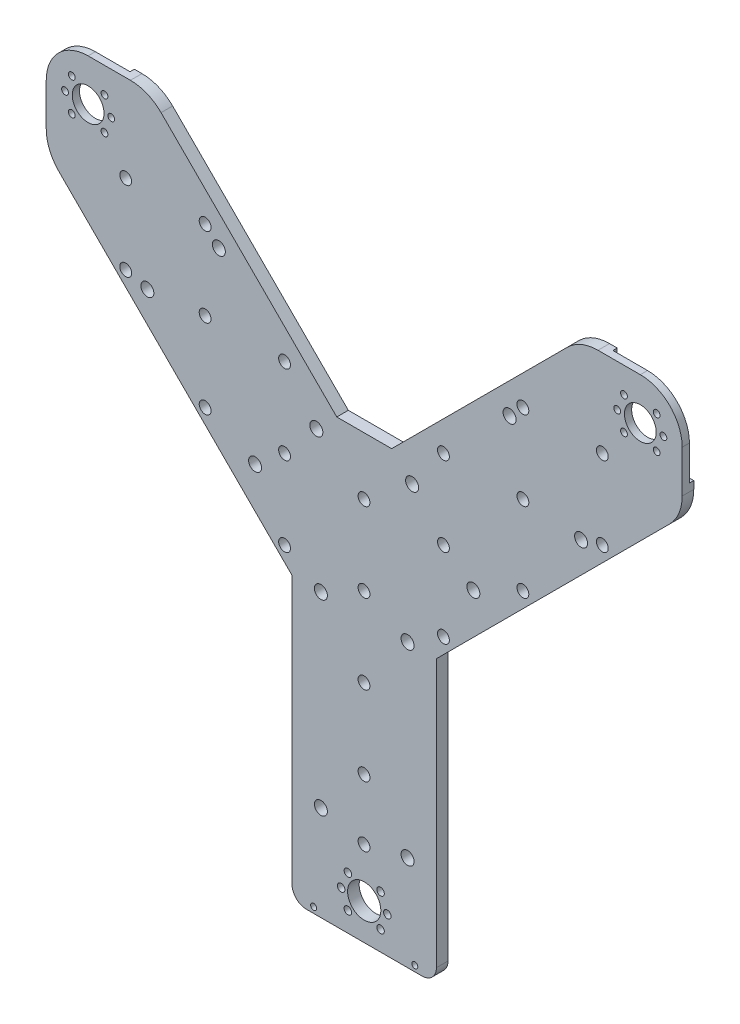
from build123d import *

# Parameters (mm, degrees)
ESQUISSE1_R               = 29
BOSS_EXTRU_1_DEPTH        = 4
ENL_V_START               = -6
ENL_V_MAT_EXTRU_1_DEPTH   = 6
BOSS_EXTRU_3_START        = 4
BOSS_EXTRU_3_DEPTH        = 4
ESQUISSE8_R               = 11
ENL_V_MAT_EXTRU_2_DEPTH   = 12
ESQUISSE10_R              = 2.5
ENL_V_MAT_EXTRU_4_DEPTH   = 12
ESQUISSE11_R              = 4.5
ENL_V_MAT_EXTRU_5_DEPTH   = 14
TROU_TARAUD_M5X0_81_D     = 4.2
TROU_TARAUD_M5X0_81_DEPTH = 14
TROU_TARAUD_M5X0_81_TIP   = 1.2618073
ESQUISSE14_R              = 2.5
ESQUISSE14_R_2            = 11
BOSS_EXTRU_4_DEPTH        = 4
BOSS_EXTRU_5_DEPTH        = 1
ESQUISSE17_R              = 2.6
ESQUISSE17_R_2            = 2.5
ESQUISSE17_R_3            = 11.5
ESQUISSE17_R_4            = 11
ENL_V_MAT_EXTRU_7_DEPTH   = 10
ESQUISSE18_R              = 11
ESQUISSE18_R_2            = 2.35
ENL_V_MAT_EXTRU_8_DEPTH   = 10
ESQUISSE19_R              = 4.1
ENL_V_MAT_EXTRU_9_DEPTH   = 8


with BuildPart() as part:
    # Esquisse1 → Boss.-Extru.1 (new body)
    with BuildSketch(Plane.XY):
        with BuildLine():
            Line((-40, -25), (40, -25))
            ThreePointArc((40, -25), (47.071067812, -22.071067812), (50, -15))
            Line((50, -15), (50, 170.289321881))
            Line((50, 170.289321881), (211.363203436, 331.652525317))
            ThreePointArc((211.363203436, 331.652525317), (217.866385975, 341.385225782), (220.15, 352.865728753))
            Line((220.15, 352.865728753), (220.15, 382.15))
            ThreePointArc((220.15, 382.15), (170.643903346, 361.643903346), (191.15, 411.15))
            Line((191.15, 411.15), (161.865728753, 411.15))
            ThreePointArc((161.865728753, 411.15), (150.385225782, 408.866385975), (140.652525317, 402.363203436))
            Line((140.652525317, 402.363203436), (19, 280.710678119))
            Line((19, 280.710678119), (-19, 280.710678119))
            Line((-19, 280.710678119), (-140.652525317, 402.363203436))
            ThreePointArc((-140.652525317, 402.363203436), (-150.385225782, 408.866385975), (-161.865728753, 411.15))
            Line((-161.865728753, 411.15), (-191.15, 411.15))
            ThreePointArc((-191.15, 411.15), (-170.643903346, 402.656096654), (-162.15, 382.15))
            ThreePointArc((-162.15, 382.15), (-191.15, 353.15), (-220.15, 382.15))
            Line((-220.15, 382.15), (-220.15, 352.865728753))
            ThreePointArc((-220.15, 352.865728753), (-217.866385975, 341.385225782), (-211.363203436, 331.652525317))
            Line((-211.363203436, 331.652525317), (-50, 170.289321881))
            Line((-50, 170.289321881), (-50, -15))
            ThreePointArc((-50, -15), (-47.071067812, -22.071067812), (-40, -25))
        make_face()
        with Locations((191.15, 382.15)):
            Circle(ESQUISSE1_R)
        with Locations((-191.15, 382.15)):
            Circle(ESQUISSE1_R)
    extrude(amount=-BOSS_EXTRU_1_DEPTH)

    # Esquisse4 → Enlèv. mat.-Extru.1 (cut)
    with BuildSketch(Plane(origin=(0, 0, -4), x_dir=(-1, 0, 0), z_dir=(0, 0, -1)).offset(ENL_V_START)):
        with BuildLine():
            Line((-14.875216904, -15), (14.875216904, -15))
            ThreePointArc((14.875216904, -15), (14.990842441, -14.97682257), (15.088601959, -14.910871568))
            ThreePointArc((15.088601959, -14.910871568), (21.213203436, 0), (15.088601959, 14.910871568))
            ThreePointArc((15.088601959, 14.910871568), (14.990842441, 14.97682257), (14.875216904, 15))
            Line((14.875216904, 15), (-14.875216904, 15))
            ThreePointArc((-14.875216904, 15), (-14.990842441, 14.97682257), (-15.088601959, 14.910871568))
            ThreePointArc((-15.088601959, 14.910871568), (-21.213203436, 0), (-15.088601959, -14.910871568))
            ThreePointArc((-15.088601959, -14.910871568), (-14.990842441, -14.97682257), (-14.875216904, -15))
        make_face()
        with BuildLine():
            Line((-191.15, 358.15), (-220.15, 358.15))
            Line((-220.15, 358.15), (-220.15, 382.15))
            ThreePointArc((-220.15, 382.15), (-211.656096654, 402.656096654), (-191.15, 411.15))
            Line((-191.15, 411.15), (-167.15, 411.15))
            Line((-167.15, 411.15), (-167.15, 382.15))
            ThreePointArc((-167.15, 382.15), (-174.179437252, 365.179437252), (-191.15, 358.15))
        make_face()
        with BuildLine():
            Line((191.15, 358.15), (220.15, 358.15))
            Line((220.15, 358.15), (220.15, 382.15))
            ThreePointArc((220.15, 382.15), (211.656096654, 402.656096654), (191.15, 411.15))
            Line((191.15, 411.15), (167.15, 411.15))
            Line((167.15, 411.15), (167.15, 382.15))
            ThreePointArc((167.15, 382.15), (174.179437252, 365.179437252), (191.15, 358.15))
        make_face()
    extrude(amount=ENL_V_MAT_EXTRU_1_DEPTH, mode=Mode.SUBTRACT)

    # Esquisse7 → Boss.-Extru.3 (add)
    with BuildSketch(Plane.XY.offset(BOSS_EXTRU_3_START)):
        with BuildLine():
            Line((220.15, 382.15), (220.15, 352.865728753))
            ThreePointArc((220.15, 352.865728753), (217.866385975, 341.385225782), (211.363203436, 331.652525317))
            Line((211.363203436, 331.652525317), (50, 170.289321881))
            Line((50, 170.289321881), (50, -15))
            ThreePointArc((50, -15), (47.071067812, -22.071067812), (40, -25))
            Line((40, -25), (-40, -25))
            ThreePointArc((-40, -25), (-47.071067812, -22.071067812), (-50, -15))
            Line((-50, -15), (-50, 170.289321881))
            Line((-50, 170.289321881), (-211.363203436, 331.652525317))
            ThreePointArc((-211.363203436, 331.652525317), (-217.866385975, 341.385225782), (-220.15, 352.865728753))
            Line((-220.15, 352.865728753), (-220.15, 382.15))
            ThreePointArc((-220.15, 382.15), (-211.656096654, 402.656096654), (-191.15, 411.15))
            Line((-191.15, 411.15), (-161.865728753, 411.15))
            ThreePointArc((-161.865728753, 411.15), (-150.385225782, 408.866385975), (-140.652525317, 402.363203436))
            Line((-140.652525317, 402.363203436), (-19, 280.710678119))
            Line((-19, 280.710678119), (19, 280.710678119))
            Line((19, 280.710678119), (140.652525317, 402.363203436))
            ThreePointArc((140.652525317, 402.363203436), (150.385225782, 408.866385975), (161.865728753, 411.15))
            Line((161.865728753, 411.15), (191.15, 411.15))
            ThreePointArc((191.15, 411.15), (211.656096654, 402.656096654), (220.15, 382.15))
        make_face()
    extrude(amount=-BOSS_EXTRU_3_DEPTH)

    # Esquisse8 → Enlèv. mat.-Extru.2 (cut)
    with BuildSketch(Plane(origin=(0, 0, -4), x_dir=(-1, 0, 0), z_dir=(0, 0, -1))):
        with Locations(Location((0, 0, 0), (0, 0, 180))):
            Circle(ESQUISSE8_R)
    extrude(amount=-ENL_V_MAT_EXTRU_2_DEPTH, mode=Mode.SUBTRACT)

    # Esquisse10 → Enlèv. mat.-Extru.4 (cut)
    with BuildSketch(Plane(origin=(0, 0, -4), x_dir=(-1, 0, 0), z_dir=(0, 0, -1))):
        with Locations(Location((-11.313708499, -11.313708499, 0), (0, 0, 180))):
            Circle(ESQUISSE10_R)
        with Locations(Location((16, 0, 0), (0, 0, 180))):
            Circle(ESQUISSE10_R)
        with Locations(Location((11.313708499, 11.313708499, 0), (0, 0, 180))):
            Circle(ESQUISSE10_R)
        with Locations(Location((-16, 0, 0), (0, 0, 180))):
            Circle(ESQUISSE10_R)
        with Locations(Location((11.313708499, -11.313708499, 0), (0, 0, 180))):
            Circle(ESQUISSE10_R)
        with Locations(Location((-11.313708499, 11.313708499, 0), (0, 0, 180))):
            Circle(ESQUISSE10_R)
    extrude(amount=-ENL_V_MAT_EXTRU_4_DEPTH, mode=Mode.SUBTRACT)

    # Esquisse11 → Enlèv. mat.-Extru.5 (cut)
    with BuildSketch(Plane(origin=(0, 0, -4), x_dir=(-1, 0, 0), z_dir=(0, 0, -1))):
        with Locations((100.652525317, 341.15)):
            Circle(ESQUISSE11_R)
        with Locations((150.15, 291.652525317)):
            Circle(ESQUISSE11_R)
        with Locations((30, 40.849999998)):
            Circle(ESQUISSE11_R)
        with Locations((-30, 40.849999998)):
            Circle(ESQUISSE11_R)
        with Locations((75.568542495, 224.142135624)):
            Circle(ESQUISSE11_R)
        with Locations((30, 170.289321881)):
            Circle(ESQUISSE11_R)
        with Locations((-30, 170.289321881)):
            Circle(ESQUISSE11_R)
        with Locations((-75.568542495, 224.142135624)):
            Circle(ESQUISSE11_R)
        with Locations((-33.142135624, 266.568542495)):
            Circle(ESQUISSE11_R)
        with Locations((33.142135624, 266.568542495)):
            Circle(ESQUISSE11_R)
        with Locations((-150.15, 291.652525317)):
            Circle(ESQUISSE11_R)
        with Locations((-100.652525317, 341.15)):
            Circle(ESQUISSE11_R)
    extrude(amount=-ENL_V_MAT_EXTRU_5_DEPTH, mode=Mode.SUBTRACT)

    # Trou taraudé M5x0.81
    with Locations(Plane(origin=(0, 0, -4), x_dir=(-1, 0, 0), z_dir=(0, 0, -1))):
        with Locations((35, -21), (-35, -21)):
            Hole(TROU_TARAUD_M5X0_81_D / 2, depth=TROU_TARAUD_M5X0_81_DEPTH)
            with Locations((0, 0, -(TROU_TARAUD_M5X0_81_DEPTH + TROU_TARAUD_M5X0_81_TIP / 2))):  # 118° drill point
                Cone(0, TROU_TARAUD_M5X0_81_D / 2, TROU_TARAUD_M5X0_81_TIP, mode=Mode.SUBTRACT)

    # Esquisse14 → Boss.-Extru.4 (add)
    with BuildSketch(Plane(origin=(0, 0, 0), x_dir=(-1, 0, 0), z_dir=(0, 0, -1))):
        with BuildLine():
            Line((-14.875216904, -15), (14.875216904, -15))
            ThreePointArc((14.875216904, -15), (14.990842441, -14.97682257), (15.088601959, -14.910871568))
            ThreePointArc((15.088601959, -14.910871568), (21.213203436, 0), (15.088601959, 14.910871568))
            ThreePointArc((15.088601959, 14.910871568), (14.990842441, 14.97682257), (14.875216904, 15))
            Line((14.875216904, 15), (-14.875216904, 15))
            ThreePointArc((-14.875216904, 15), (-14.990842441, 14.97682257), (-15.088601959, 14.910871568))
            ThreePointArc((-15.088601959, 14.910871568), (-21.213203436, 0), (-15.088601959, -14.910871568))
            ThreePointArc((-15.088601959, -14.910871568), (-14.990842441, -14.97682257), (-14.875216904, -15))
        make_face()
        with Locations(Location((11.313708499, -11.313708499, 0), (0, 0, 180))):
            Circle(ESQUISSE14_R, mode=Mode.SUBTRACT)
        with Locations(Location((-11.313708499, -11.313708499, 0), (0, 0, 180))):
            Circle(ESQUISSE14_R, mode=Mode.SUBTRACT)
        with Locations(Location((-16, 0, 0), (0, 0, 180))):
            Circle(ESQUISSE14_R, mode=Mode.SUBTRACT)
        with Locations(Location((-11.313708499, 11.313708499, 0), (0, 0, 180))):
            Circle(ESQUISSE14_R, mode=Mode.SUBTRACT)
        with Locations(Location((11.313708499, 11.313708499, 0), (0, 0, 180))):
            Circle(ESQUISSE14_R, mode=Mode.SUBTRACT)
        with Locations(Location((16, 0, 0), (0, 0, 180))):
            Circle(ESQUISSE14_R, mode=Mode.SUBTRACT)
        with Locations(Location((0, 0, 0), (0, 0, 180))):
            Circle(ESQUISSE14_R_2, mode=Mode.SUBTRACT)
    extrude(amount=BOSS_EXTRU_4_DEPTH)

    # Esquisse15 → Boss.-Extru.5 (add)
    with BuildSketch(Plane(origin=(0, 0, 0), x_dir=(-1, 0, 0), z_dir=(0, 0, -1))):
        with BuildLine():
            Line((191.15, 411.15), (167.15, 411.15))
            Line((167.15, 411.15), (167.15, 382.15))
            ThreePointArc((167.15, 382.15), (174.179437252, 365.179437252), (191.15, 358.15))
            Line((191.15, 358.15), (220.15, 358.15))
            Line((220.15, 358.15), (220.15, 382.15))
            ThreePointArc((220.15, 382.15), (211.656096654, 402.656096654), (191.15, 411.15))
        make_face()
        with BuildLine():
            Line((-220.15, 382.15), (-220.15, 358.15))
            Line((-220.15, 358.15), (-191.15, 358.15))
            ThreePointArc((-191.15, 358.15), (-174.179437252, 365.179437252), (-167.15, 382.15))
            Line((-167.15, 382.15), (-167.15, 411.15))
            Line((-167.15, 411.15), (-191.15, 411.15))
            ThreePointArc((-191.15, 411.15), (-211.656096654, 402.656096654), (-220.15, 382.15))
        make_face()
    extrude(amount=BOSS_EXTRU_5_DEPTH)

    # Esquisse17 → Enlèv. mat.-Extru.7 (cut)
    # profile 1 of 7: a face of its own
    with BuildSketch(Plane(origin=(0, 0, -4), x_dir=(-1, 0, 0), z_dir=(0, 0, -1))):
        with Locations((-11.313708499, 11.313708499)):
            Circle(ESQUISSE17_R)
        with Locations((-11.313708499, 11.313708499)):
            Circle(ESQUISSE17_R_2, mode=Mode.SUBTRACT)
    # profile 2 of 7: a face of its own
    with BuildSketch(Plane(origin=(0, 0, -4), x_dir=(-1, 0, 0), z_dir=(0, 0, -1))):
        with Locations((-16, 0)):
            Circle(ESQUISSE17_R)
        with Locations((-16, 0)):
            Circle(ESQUISSE17_R_2, mode=Mode.SUBTRACT)
    # profile 3 of 7: a face of its own
    with BuildSketch(Plane(origin=(0, 0, -4), x_dir=(-1, 0, 0), z_dir=(0, 0, -1))):
        with Locations((-11.313708499, -11.313708499)):
            Circle(ESQUISSE17_R)
        with Locations((-11.313708499, -11.313708499)):
            Circle(ESQUISSE17_R_2, mode=Mode.SUBTRACT)
    # profile 4 of 7: a face of its own
    with BuildSketch(Plane(origin=(0, 0, -4), x_dir=(-1, 0, 0), z_dir=(0, 0, -1))):
        with Locations((11.313708499, -11.313708499)):
            Circle(ESQUISSE17_R)
        with Locations((11.313708499, -11.313708499)):
            Circle(ESQUISSE17_R_2, mode=Mode.SUBTRACT)
    # profile 5 of 7: a face of its own
    with BuildSketch(Plane(origin=(0, 0, -4), x_dir=(-1, 0, 0), z_dir=(0, 0, -1))):
        with Locations((16, 0)):
            Circle(ESQUISSE17_R)
        with Locations((16, 0)):
            Circle(ESQUISSE17_R_2, mode=Mode.SUBTRACT)
    # profile 6 of 7: a face of its own
    with BuildSketch(Plane(origin=(0, 0, -4), x_dir=(-1, 0, 0), z_dir=(0, 0, -1))):
        with Locations((11.313708499, 11.313708499)):
            Circle(ESQUISSE17_R)
        with Locations((11.313708499, 11.313708499)):
            Circle(ESQUISSE17_R_2, mode=Mode.SUBTRACT)
    # profile 7 of 7: a face of its own
    with BuildSketch(Plane(origin=(0, 0, -4), x_dir=(-1, 0, 0), z_dir=(0, 0, -1))):
        Circle(ESQUISSE17_R_3)
        Circle(ESQUISSE17_R_4, mode=Mode.SUBTRACT)
    extrude(amount=-ENL_V_MAT_EXTRU_7_DEPTH, mode=Mode.SUBTRACT)

    # Esquisse18 → Enlèv. mat.-Extru.8 (cut)
    with BuildSketch(Plane(origin=(0, 0, -1), x_dir=(-1, 0, 0), z_dir=(0, 0, -1))):
        with Locations((-191.15, 382.15)):
            Circle(ESQUISSE18_R)
        with Locations((191.15, 382.15)):
            Circle(ESQUISSE18_R)
        with Locations((179.836291501, 370.836291501)):
            Circle(ESQUISSE18_R_2)
        with Locations((175.15, 382.15)):
            Circle(ESQUISSE18_R_2)
        with Locations((179.836291501, 393.463708499)):
            Circle(ESQUISSE18_R_2)
        with Locations((202.463708499, 393.463708499)):
            Circle(ESQUISSE18_R_2)
        with Locations((207.15, 382.15)):
            Circle(ESQUISSE18_R_2)
        with Locations((202.463708499, 370.836291501)):
            Circle(ESQUISSE18_R_2)
        with Locations((-202.463708499, 393.463708499)):
            Circle(ESQUISSE18_R_2)
        with Locations((-207.15, 382.15)):
            Circle(ESQUISSE18_R_2)
        with Locations((-202.463708499, 370.836291501)):
            Circle(ESQUISSE18_R_2)
        with Locations((-179.836291501, 393.463708499)):
            Circle(ESQUISSE18_R_2)
        with Locations((-175.15, 382.15)):
            Circle(ESQUISSE18_R_2)
        with Locations((-179.836291501, 370.836291501)):
            Circle(ESQUISSE18_R_2)
    extrude(amount=-ENL_V_MAT_EXTRU_8_DEPTH, mode=Mode.SUBTRACT)

    # Esquisse19 → Enlèv. mat.-Extru.9 (cut)
    with BuildSketch(Plane.XY.offset(4)):
        with Locations((-110.15, 350.849999998)):
            Circle(ESQUISSE19_R)
        with Locations((-165.15, 295.849999998)):
            Circle(ESQUISSE19_R)
        with Locations((-55.15, 295.849999998)):
            Circle(ESQUISSE19_R)
        with Locations((-110.15, 295.849999998)):
            Circle(ESQUISSE19_R)
        with Locations((-110.15, 240.849999998)):
            Circle(ESQUISSE19_R)
        with Locations((-55.15, 240.849999998)):
            Circle(ESQUISSE19_R)
        with Locations((-0.15, 240.849999998)):
            Circle(ESQUISSE19_R)
        with Locations((-0.15, 185.849999998)):
            Circle(ESQUISSE19_R)
        with Locations((-55.15, 185.849999998)):
            Circle(ESQUISSE19_R)
        with Locations((54.85, 240.849999998)):
            Circle(ESQUISSE19_R)
        with Locations((109.85, 295.849999998)):
            Circle(ESQUISSE19_R)
        with Locations((54.85, 295.849999998)):
            Circle(ESQUISSE19_R)
        with Locations((109.85, 240.849999998)):
            Circle(ESQUISSE19_R)
        with Locations((164.85, 350.849999998)):
            Circle(ESQUISSE19_R)
        with Locations((109.85, 350.849999998)):
            Circle(ESQUISSE19_R)
        with Locations((164.85, 295.849999998)):
            Circle(ESQUISSE19_R)
        with Locations((-0.15, 130.849999998)):
            Circle(ESQUISSE19_R)
        with Locations((-0.15, 75.849999998)):
            Circle(ESQUISSE19_R)
        with Locations((-0.15, 33.849999998)):
            Circle(ESQUISSE19_R)
        with Locations((54.85, 185.849999998)):
            Circle(ESQUISSE19_R)
        with Locations((-165.15, 350.849999998)):
            Circle(ESQUISSE19_R)
    extrude(amount=-ENL_V_MAT_EXTRU_9_DEPTH, mode=Mode.SUBTRACT)


solid = part.part
